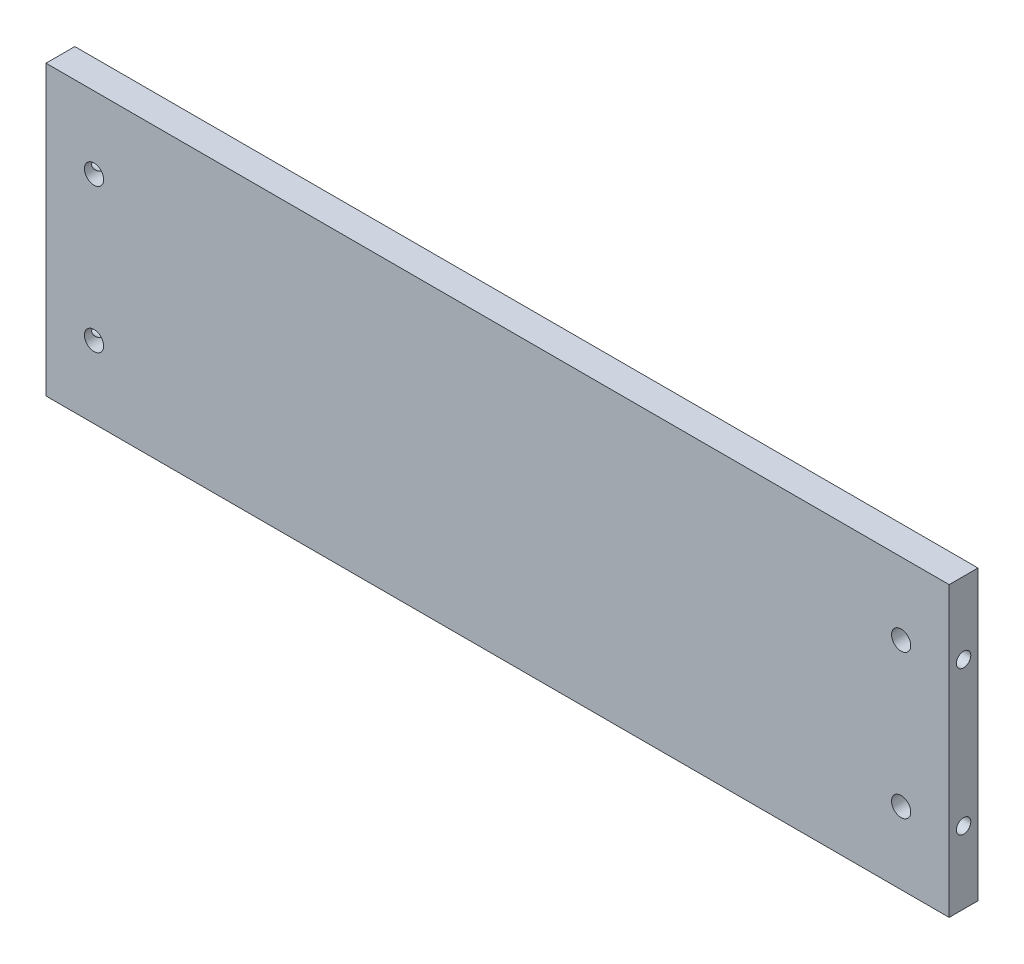
from build123d import *

# Parameters (mm, degrees)
SKETCH1_W           = 376
SKETCH1_H           = 120
BOSS_EXTRUDE1_DEPTH = 12
CUT_EXTRUDE1_REACH  = 199.707
SKETCH2_R           = 4
CUT_EXTRUDE2_REACH  = 382.946
SKETCH3_R           = 3


with BuildPart() as part:
    # Sketch1 → Boss-Extrude1 (new body)
    with BuildSketch(Plane.XY):
        Rectangle(SKETCH1_W, SKETCH1_H)
    extrude(amount=BOSS_EXTRUDE1_DEPTH)

    # Sketch2 → Cut-Extrude1 (cut, up to next)
    with BuildSketch(Plane.XY.offset(12), mode=Mode.PRIVATE) as cut_extrude1_sk1:
        with Locations((-168, 30)):
            Circle(SKETCH2_R)
    cut_extrude1_tool1 = extrude(cut_extrude1_sk1.sketch, amount=-CUT_EXTRUDE1_REACH, mode=Mode.PRIVATE) & part.part
    # Sketch2 → Cut-Extrude1 (cut, up to next)
    with BuildSketch(Plane.XY.offset(12), mode=Mode.PRIVATE) as cut_extrude1_sk2:
        with Locations((-168, -30)):
            Circle(SKETCH2_R)
    cut_extrude1_tool2 = extrude(cut_extrude1_sk2.sketch, amount=-CUT_EXTRUDE1_REACH, mode=Mode.PRIVATE) & part.part
    cut_extrude1_1 = cut_extrude1_tool1.solids().sort_by_distance((-168, 30, 12))[0]
    add(cut_extrude1_1, mode=Mode.SUBTRACT)
    cut_extrude1_2 = cut_extrude1_tool2.solids().sort_by_distance((-168, -30, 12))[0]
    add(cut_extrude1_2, mode=Mode.SUBTRACT)
    cut_extrude1 = cut_extrude1_1 + cut_extrude1_2  # Cut-Extrude1 as one shape, for the pattern or mirror that repeats it

    # Sketch3 → Cut-Extrude2 (cut, up to next)
    with BuildSketch(Plane.ZY.offset(188), mode=Mode.PRIVATE) as cut_extrude2_sk1:
        with Locations((6, 30)):
            Circle(SKETCH3_R)
    cut_extrude2_tool1 = extrude(cut_extrude2_sk1.sketch, amount=-CUT_EXTRUDE2_REACH, mode=Mode.PRIVATE) & part.part
    # Sketch3 → Cut-Extrude2 (cut, up to next)
    with BuildSketch(Plane.ZY.offset(188), mode=Mode.PRIVATE) as cut_extrude2_sk2:
        with Locations((6, -30)):
            Circle(SKETCH3_R)
    cut_extrude2_tool2 = extrude(cut_extrude2_sk2.sketch, amount=-CUT_EXTRUDE2_REACH, mode=Mode.PRIVATE) & part.part
    cut_extrude2_1 = cut_extrude2_tool1.solids().sort_by_distance((-188, 30, 6))[0]
    add(cut_extrude2_1, mode=Mode.SUBTRACT)
    cut_extrude2_2 = cut_extrude2_tool2.solids().sort_by_distance((-188, -30, 6))[0]
    add(cut_extrude2_2, mode=Mode.SUBTRACT)
    cut_extrude2 = cut_extrude2_1 + cut_extrude2_2  # Cut-Extrude2 as one shape, for the pattern or mirror that repeats it

    # Mirror1: Cut-Extrude1, Cut-Extrude2 across plane
    add(cut_extrude1.mirror(Plane(origin=(0, 0, 0), x_dir=(0, 0, 1), z_dir=(1, 0, 0))), mode=Mode.SUBTRACT)
    add(cut_extrude2.mirror(Plane(origin=(0, 0, 0), x_dir=(0, 0, 1), z_dir=(1, 0, 0))), mode=Mode.SUBTRACT)


solid = part.part
